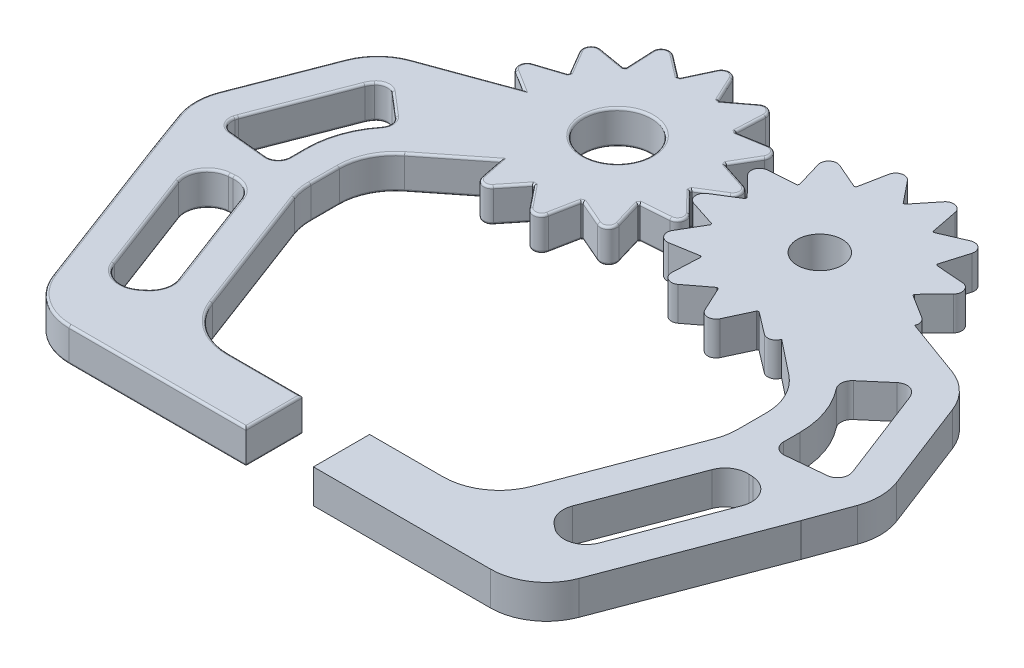
from build123d import *

# Parameters (mm, degrees)
BOSS_EXTRUDE1_DEPTH = 3
BOSS_EXTRUDE2_DEPTH = 3
SKETCH3_R           = 3
CUT_EXTRUDE1_DEPTH  = 3
BOSS_EXTRUDE3_DEPTH = 3
SKETCH5_R           = 1.9999999999999996
CUT_EXTRUDE2_DEPTH  = 10
FILLET1_R           = 0.2


with BuildPart() as part:
    # Sketch1 → Boss-Extrude1 (new body)
    with BuildSketch(Plane(origin=(0, 0, 0), x_dir=(1, 0, 0), z_dir=(0, 1, 0))):
        with BuildLine():
            Line((-8.32026915972251, 9.542312508941123), (-7.2740588316116535, 7.298707219998776))
            ThreePointArc((-7.2740588316116535, 7.298707219998776), (-7.205132517843315, 7.282063630695389), (-7.136366636375814, 7.264769141960864))
            Line((-7.136366636375814, 7.264769141960864), (-5.167338030557971, 8.765184781937645))
            ThreePointArc((-5.167338030557971, 8.765184781937645), (-4.364224257548944, 8.83273271414079), (-3.963594493865928, 8.133411437478186))
            Line((-3.963594493865928, 8.133411437478186), (-4.07987662143101, 5.660599432892145))
            ThreePointArc((-4.07987662143101, 5.660599432892145), (-4.026580063194036, 5.613830611283259), (-3.9737280487528657, 5.5665600034587195))
            Line((-3.9737280487528657, 5.5665600034587195), (-1.532961889453826, 5.980058853319892))
            ThreePointArc((-1.532961889453826, 5.980058853319892), (-0.7904488705394567, 5.6666439968047815), (-0.7606996341986512, 4.86124382392247))
            Line((-0.7606996341986512, 4.86124382392247), (-2.0128353833660646, 2.7257165333282076))
            ThreePointArc((-2.0128353833660646, 2.7257165333282076), (-1.9873781798593884, 2.6595366528190167), (-1.9625477920172012, 2.593119052484485))
            Line((-1.9625477920172012, 2.593119052484485), (0.3908058080885112, 1.8249735089281953))
            ThreePointArc((0.3908058080885112, 1.8249735089281953), (0.9026172885268505, 1.2023954302639746), (0.5546708059969309, 0.4754238346450154))
            Line((0.5546708059969309, 0.4754238346450154), (-1.5464693545101504, -0.8335951755760636))
            ThreePointArc((-1.5464693545101504, -0.8335951755760636), (-1.5546834442645956, -0.9040251019149228), (-1.563563025637423, -0.97437422294166))
            Line((-1.563563025637423, -0.97437422294166), (0.1632530664760889, -2.7481912730439846))
            ThreePointArc((0.1632530664760889, -2.7481912730439846), (0.32711316626695397, -3.5373074389145374), (-0.31881868919576145, -4.019310025671297))
            Line((-0.31881868919576145, -4.019310025671297), (-2.7876173717542465, -4.201940275666751))
            ThreePointArc((-2.7876173717542465, -4.201940275666751), (-2.8276210057975746, -4.260485600483667), (-2.8681763513034584, -4.318650106374195))
            Line((-2.8681763513034584, -4.318650106374195), (-2.1634905234954904, -6.691778553656916))
            ThreePointArc((-2.1634905234954904, -6.691778553656916), (-2.385120178485919, -7.466655803013577), (-3.1810622031176425, -7.5932683970430315))
            Line((-3.1810622031176425, -7.5932683970430315), (-5.451947381802793, -6.607671497472004))
            ThreePointArc((-5.451947381802793, -6.607671497472004), (-5.514576209671734, -6.640920192399074), (-5.577516578400171, -6.673575295812158))
            Line((-5.577516578400171, -6.673575295812158), (-6.056396045663718, -9.102360012300897))
            ThreePointArc((-6.056396045663718, -9.102360012300897), (-6.612742772404009, -9.685483305599218), (-7.376354240502842, -9.427700487456391))
            Line((-7.376354240502842, -9.427700487456391), (-8.929093488011025, -7.49966481028036))
            ThreePointArc((-8.929093488011025, -7.49966481028036), (-8.999999999999998, -7.499999999999999), (-9.070906511988971, -7.499664810280359))
            Line((-9.070906511988971, -7.499664810280359), (-10.62364575949715, -9.42770048745639))
            ThreePointArc((-10.62364575949715, -9.42770048745639), (-11.387257227595983, -9.685483305599224), (-11.943603954336274, -9.102360012300897))
            Line((-11.943603954336274, -9.102360012300897), (-12.422483421599827, -6.673575295812158))
            ThreePointArc((-12.422483421599827, -6.673575295812158), (-12.48542379032826, -6.640920192399076), (-12.548052618197206, -6.6076714974720065))
            Line((-12.548052618197206, -6.6076714974720065), (-14.818937796882352, -7.593268397043037))
            ThreePointArc((-14.818937796882352, -7.593268397043037), (-15.61487982151408, -7.466655803013584), (-15.836509476504505, -6.6917785536569205))
            Line((-15.836509476504505, -6.6917785536569205), (-15.13182364869654, -4.318650106374199))
            ThreePointArc((-15.13182364869654, -4.318650106374199), (-15.172378994202422, -4.260485600483667), (-15.212382628245752, -4.201940275666751))
            Line((-15.212382628245752, -4.201940275666751), (-17.681181310804234, -4.0193100256713))
            ThreePointArc((-17.681181310804234, -4.0193100256713), (-18.32711316626695, -3.5373074389145396), (-18.163253066476084, -2.7481912730439872))
            Line((-18.163253066476084, -2.7481912730439872), (-16.436436974362575, -0.97437422294166))
            ThreePointArc((-16.436436974362575, -0.97437422294166), (-16.445316555735403, -0.9040251019149261), (-16.453530645489845, -0.8335951755760688))
            Line((-16.453530645489845, -0.8335951755760688), (-18.554670805996928, 0.4754238346450085))
            ThreePointArc((-18.554670805996928, 0.4754238346450085), (-18.902617288526848, 1.2023954302639674), (-18.39080580808851, 1.8249735089281884))
            Line((-18.39080580808851, 1.8249735089281884), (-16.0374522079828, 2.59311905248448))
            ThreePointArc((-16.0374522079828, 2.59311905248448), (-16.012621820140613, 2.6595366528190163), (-15.987164616633937, 2.7257165333282085))
            Line((-15.987164616633937, 2.7257165333282085), (-17.23930036580135, 4.861243823922467))
            ThreePointArc((-17.23930036580135, 4.861243823922467), (-17.209551129460547, 5.666643996804776), (-16.467038110546177, 5.980058853319887))
            Line((-16.467038110546177, 5.980058853319887), (-14.026271951247134, 5.566560003458716))
            ThreePointArc((-14.026271951247134, 5.566560003458716), (-13.973419936805964, 5.613830611283257), (-13.920123378568993, 5.66059943289214))
            Line((-13.920123378568993, 5.66059943289214), (-14.036405506134075, 8.133411437478182))
            ThreePointArc((-14.036405506134075, 8.133411437478182), (-13.635775742451063, 8.832732714140782), (-12.832661969442034, 8.765184781937643))
            Line((-12.832661969442034, 8.765184781937643), (-10.863633363624189, 7.264769141960862))
            ThreePointArc((-10.863633363624189, 7.264769141960862), (-10.794867482156684, 7.282063630695389), (-10.725941168388344, 7.298707219998776))
            Line((-10.725941168388344, 7.298707219998776), (-9.679730840277488, 9.542312508941123))
            ThreePointArc((-9.679730840277488, 9.542312508941123), (-9, 9.975348812635602), (-8.32026915972251, 9.542312508941123))
        make_face()
    extrude(amount=BOSS_EXTRUDE1_DEPTH)

    # Sketch3 → Cut-Extrude1 (cut)
    with BuildSketch(Plane(origin=(0, 3, 0), x_dir=(1, 0, 0), z_dir=(0, 1, 0))):
        with Locations(Location((-9, 0, 0), (0, 0, 270))):
            Circle(SKETCH3_R)
    extrude(amount=-CUT_EXTRUDE1_DEPTH, mode=Mode.SUBTRACT)



with BuildPart() as body_2:
    # Sketch2 → Boss-Extrude2 (new body)
    with BuildSketch(Plane(origin=(0, 0, 0), x_dir=(1, 0, 0), z_dir=(0, 1, 0))):
        with BuildLine():
            Line((11.943420646641036, 9.102419289971532), (12.42234902568069, 6.673644217848479))
            ThreePointArc((12.42234902568069, 6.673644217848479), (12.485290052018371, 6.640990381961248), (12.547919549450615, 6.607742948286211))
            Line((12.547919549450615, 6.607742948286211), (14.818784879316434, 7.593385579684269))
            ThreePointArc((14.818784879316434, 7.593385579684269), (15.614729453563658, 7.4667890146908595), (15.836374713308329, 6.691916228761162))
            Line((15.836374713308329, 6.691916228761162), (15.131736676687458, 4.318773590704409))
            ThreePointArc((15.131736676687458, 4.318773590704409), (15.172293193526045, 4.2606099015460295), (15.21229800657128, 4.202065382350745))
            Line((15.21229800657128, 4.202065382350745), (17.681100366512805, 4.019484850083378))
            ThreePointArc((17.681100366512805, 4.019484850083378), (18.327041928612402, 3.537495271467764), (18.163197720403158, 2.7483758058746197))
            Line((18.163197720403158, 2.7483758058746197), (16.436417350502705, 0.9745239807938582))
            ThreePointArc((16.436417350502705, 0.9745239807938582), (16.445298348593486, 0.9041750386020764), (16.45351385669331, 0.8337452776962431))
            Line((16.45351385669331, 0.8337452776962431), (18.554680378341672, -0.4752314186280363))
            ThreePointArc((18.554680378341672, -0.4752314186280363), (18.90264150085632, -1.2021960070091147), (18.390842558257134, -1.8247843926188032))
            Line((18.390842558257134, -1.8247843926188032), (16.03750442786194, -2.59297732882946))
            ThreePointArc((16.03750442786194, -2.59297732882946), (16.012675377569952, -2.6593954291951656), (15.9872195068263, -2.7255758223586524))
            Line((15.9872195068263, -2.7255758223586524), (17.239398261873443, -4.861077896491214))
            ThreePointArc((17.239398261873443, -4.861077896491214), (17.209665245021146, -5.666478668312662), (16.467158537935614, -5.979908477799127))
            Line((16.467158537935614, -5.979908477799127), (14.026384051920298, -5.56645878118228))
            ThreePointArc((14.026384051920298, -5.56645878118228), (13.973532989444935, -5.613730453353005), (13.920237373068682, -5.660500348260586))
            Line((13.920237373068682, -5.660500348260586), (14.036569299123181, -8.133310010607516))
            ThreePointArc((14.036569299123181, -8.133310010607516), (13.6359536187431, -8.832639355176532), (12.832838485588669, -8.765107596425096))
            Line((12.832838485588669, -8.765107596425096), (10.863779664178109, -7.264731609866681))
            ThreePointArc((10.863779664178109, -7.264731609866681), (10.795014131008132, -7.28202748343352), (10.72608815242927, -7.298672460800205))
            Line((10.72608815242927, -7.298672460800205), (9.679923007183724, -9.542298818304783))
            ThreePointArc((9.679923007183724, -9.542298818304783), (9.000200887708619, -9.975348810612823), (8.32046132690441, -9.542326195707528))
            Line((8.32046132690441, -9.542326195707528), (7.274205816352543, -7.298741976237317))
            ThreePointArc((7.274205816352543, -7.298741976237317), (7.205279167422684, -7.28209977500398), (7.136512937685543, -7.264806671108782))
            Line((7.136512937685543, -7.264806671108782), (5.167514548258975, -8.765261963895432))
            ThreePointArc((5.167514548258975, -8.765261963895432), (4.364402135721049, -8.832826069522877), (3.9637582888975738, -8.133512861050301))
            Line((3.9637582888975738, -8.133512861050301), (4.079990617926086, -5.660698515228017))
            ThreePointArc((4.079990617926086, -5.660698515228017), (4.026693117850007, -5.613930766936794), (3.973840151464462, -5.566661223477609))
            Line((3.973840151464462, -5.566661223477609), (1.5330823198715684, -5.980209226415413))
            ThreePointArc((1.5330823198715684, -5.980209226415413), (0.7905629894294881, -5.666809322998758), (0.7607975336122383, -4.861409749382212))
            Line((0.7607975336122383, -4.861409749382212), (2.012890276392112, -2.725857243192335))
            ThreePointArc((2.012890276392112, -2.725857243192335), (1.9874317401327382, -2.6596778753642805), (1.9626000147504232, -2.593260775087857))
            Line((1.9626000147504232, -2.593260775087857), (-0.3907690541113881, -1.8251626244974668))
            ThreePointArc((-0.3907690541113881, -1.8251626244974668), (-0.9025930721813178, -1.2025948530311967), (-0.5546612297772351, -0.47561625046917916))
            Line((-0.5546612297772351, -0.47561625046917916), (1.5464525687364366, 0.8334450731178134))
            ThreePointArc((1.5464525687364366, 0.8334450731178134), (1.5546652401421683, 0.9038751648611306), (1.5635434047934407, 0.9742244646942927))
            Line((1.5635434047934407, 0.9742244646942927), (-0.1633084088328192, 2.7480067390987917))
            ThreePointArc((-0.1633084088328192, 2.7480067390987917), (-0.3271844001388486, 3.5371196049267355), (0.318737748425035, 4.019135199629166))
            Line((0.318737748425035, 4.019135199629166), (2.7875327525992333, 4.201815167278632))
            ThreePointArc((2.7875327525992333, 4.201815167278632), (2.8275352076244387, 4.260361297693441), (2.868089381781175, 4.318526620292534))
            Line((2.868089381781175, 4.318526620292534), (2.1633557630719014, 6.691640875838782))
            ThreePointArc((2.1633557630719014, 6.691640875838782), (2.3849698132181945, 7.4665225883081625), (3.1809092879116303, 7.59315121132231))
            Line((3.1809092879116303, 7.59315121132231), (5.4518143144951265, 6.60760004397802))
            ThreePointArc((5.4518143144951265, 6.60760004397802), (5.514442472775373, 6.6408500001436375), (5.577382183869041, 6.6735063710693305))
            Line((5.577382183869041, 6.6735063710693305), (6.056212739162261, 9.102300730938746))
            ThreePointArc((6.056212739162261, 9.102300730938746), (6.612547722611185, 9.685435228059784), (7.376164381892408, 9.427667787893446))
            Line((7.376164381892408, 9.427667787893446), (8.928942456667253, 7.499663380814869))
            ThreePointArc((8.928942456667253, 7.499663380814869), (8.999848961891665, 7.499999998479167), (9.070755480616457, 7.4996662367043205))
            Line((9.070755480616457, 7.4996662367043205), (10.62345590022824, 9.42773318319588))
            ThreePointArc((10.62345590022824, 9.42773318319588), (11.387062176835007, 9.685531379210657), (11.943420646641036, 9.102419289971532))
        make_face()
    extrude(amount=BOSS_EXTRUDE2_DEPTH)


with BuildPart() as part_1:
    add(part.part)

    add(body_2.part)  # Boss-Extrude3 merges body 2
    # Sketch4 → Boss-Extrude3 (add)
    # profile 1 of 2: a face of its own
    with BuildSketch(Plane(origin=(0, 3, 0), x_dir=(1, 0, 0), z_dir=(0, 1, 0))):
        with BuildLine():
            Line((-12, 0), (-15, 0))
            Line((-15, 0), (-24.063417074059288, -3.298814035697665))
            ThreePointArc((-24.063417074059288, -3.298814035697665), (-25.85454510614932, -4.427767754690947), (-27.017878157162077, -6.196759653877833))
            Line((-27.017878157162077, -6.196759653877833), (-30.146834392646337, -14.302879058208777))
            ThreePointArc((-30.146834392646337, -14.302879058208777), (-30.482039475216727, -16.055114843064764), (-30.180735696844767, -17.81349726058653))
            Line((-30.180735696844767, -17.81349726058653), (-28.845259169497112, -21.48268886368583))
            ThreePointArc((-28.845259169497112, -21.48268886368583), (-28.834592468379938, -21.511715769108086), (-28.823746442220965, -21.54067614665525))
            Line((-28.823746442220965, -21.54067614665525), (-23.42086378400779, -35.832393577627286))
            ThreePointArc((-23.42086378400779, -35.832393577627286), (-21.586408790113275, -38.177725079976085), (-18.743913407354402, -39.0643055780295))
            Line((-18.743913407354402, -39.0643055780295), (-2.9999999999999973, -39.06430557802947))
            Line((-2.9999999999999973, -39.06430557802947), (-2.999999999999995, -34.0643055780295))
            Line((-2.999999999999995, -34.0643055780295), (-9.548771612533102, -34.0643055780295))
            ThreePointArc((-9.548771612533102, -34.0643055780295), (-12.391266995291975, -33.17772507997607), (-14.22572198918649, -30.832393577627283))
            Line((-14.22572198918649, -30.832393577627283), (-18.670113991755716, -19.07607779745121))
            ThreePointArc((-18.670113991755716, -19.07607779745121), (-18.91173819943399, -18.20666886090458), (-18.99316361510232, -17.307989797853402))
            Line((-18.99316361510232, -17.307989797853402), (-18.99316361510232, -14.76495875194751))
            ThreePointArc((-18.99316361510232, -14.76495875194751), (-18.494843488176148, -12.588981196833053), (-17.099212286957545, -10.846737006299845))
            Line((-17.099212286957545, -10.846737006299845), (-11.233353665963485, -6.196759653877833))
            Line((-11.233353665963485, -6.196759653877833), (-12, -5.200385990842216))
            Line((-12, -5.200385990842216), (-12, 0))
        make_face()
        with BuildLine():
            Line((-24.219141077323414, -7.277070145327466), (-27.348097312807674, -15.383189549658415))
            ThreePointArc((-27.348097312807674, -15.383189549658415), (-27.391982380778803, -15.509251337684425), (-27.42736089782193, -15.63795966734096))
            ThreePointArc((-27.42736089782193, -15.63795966734096), (-27.268909504558284, -16.451412967212818), (-26.551328527375524, -16.866009947767477))
            Line((-26.551328527375524, -16.866009947767477), (-23.089675397109268, -17.201667160924675))
            ThreePointArc((-23.089675397109268, -17.201667160924675), (-22.32104449694205, -16.946778355780893), (-21.993163615102315, -16.20633531880675))
            Line((-21.993163615102315, -16.20633531880675), (-21.993163615102315, -14.7649587519475))
            ThreePointArc((-21.993163615102315, -14.7649587519475), (-21.544176267965852, -12.122571967940548), (-20.247611636028644, -9.776784741998526))
            ThreePointArc((-20.247611636028644, -9.776784741998526), (-20.033904843359444, -9.058635962777394), (-20.379087159218226, -8.393611578902545))
            Line((-20.379087159218226, -8.393611578902545), (-22.473694408503057, -6.6004378739851415))
            ThreePointArc((-22.473694408503057, -6.6004378739851415), (-23.209885528261832, -6.363782129162567), (-23.894733418427563, -6.7229014320477685))
            ThreePointArc((-23.894733418427563, -6.7229014320477685), (-24.07932327487177, -6.986881117788997), (-24.219141077323414, -7.277070145327466))
        make_face(mode=Mode.SUBTRACT)
        with BuildLine():
            Line((-21.589342284851647, -32.19339776059977), (-25.07235384075273, -22.98012771297467))
            ThreePointArc((-25.07235384075273, -22.98012771297467), (-24.888606920379818, -21.19868635047283), (-23.352156158021938, -20.278569339637336))
            Line((-23.352156158021938, -20.278569339637336), (-22.96847863119698, -20.249599556982975))
            ThreePointArc((-22.96847863119698, -20.249599556982975), (-21.743690000603678, -20.556889500192728), (-20.94711601260503, -21.536687530642066))
            Line((-20.94711601260503, -21.536687530642066), (-17.545083905804617, -30.53575055629838))
            ThreePointArc((-17.545083905804617, -30.53575055629838), (-17.486354183386762, -31.769285717841722), (-18.16327816241805, -32.8021613646025))
            Line((-18.16327816241805, -32.8021613646025), (-18.46597624014234, -33.04533816922565))
            ThreePointArc((-18.46597624014234, -33.04533816922565), (-20.2448620958945, -33.41567243383988), (-21.589342284851647, -32.19339776059977))
        make_face(mode=Mode.SUBTRACT)
    # profile 2 of 2: a face of its own
    with BuildSketch(Plane(origin=(0, 3, 0), x_dir=(1, 0, 0), z_dir=(0, 1, 0))):
        with BuildLine():
            Line((23.42086378400779, -35.832393577627286), (28.823746442220965, -21.54067614665525))
            ThreePointArc((28.823746442220965, -21.54067614665525), (28.834592468379938, -21.511715769108086), (28.845259169497112, -21.48268886368583))
            Line((28.845259169497112, -21.48268886368583), (30.180735696844767, -17.81349726058653))
            ThreePointArc((30.180735696844767, -17.81349726058653), (30.482039475216727, -16.055114843064764), (30.146834392646337, -14.302879058208777))
            Line((30.146834392646337, -14.302879058208777), (27.017878157162077, -6.196759653877833))
            ThreePointArc((27.017878157162077, -6.196759653877833), (25.85454510614932, -4.427767754690949), (24.063417074059288, -3.298814035697665))
            Line((24.063417074059288, -3.298814035697665), (15, 0))
            Line((15, 0), (12, 0))
            Line((12, 0), (12, -5.200385990842216))
            Line((12, -5.200385990842216), (11.233353665963485, -6.196759653877833))
            Line((11.233353665963485, -6.196759653877833), (17.099212286957545, -10.846737006299845))
            ThreePointArc((17.099212286957545, -10.846737006299845), (18.494843488176148, -12.588981196833053), (18.99316361510232, -14.76495875194751))
            Line((18.99316361510232, -14.76495875194751), (18.99316361510232, -17.307989797853402))
            ThreePointArc((18.99316361510232, -17.307989797853402), (18.91173819943399, -18.20666886090458), (18.670113991755716, -19.07607779745121))
            Line((18.670113991755716, -19.07607779745121), (14.22572198918649, -30.832393577627283))
            ThreePointArc((14.22572198918649, -30.832393577627283), (12.391266995291975, -33.17772507997607), (9.548771612533102, -34.0643055780295))
            Line((9.548771612533102, -34.0643055780295), (2.999999999999995, -34.0643055780295))
            Line((2.999999999999995, -34.0643055780295), (2.9999999999999973, -39.06430557802947))
            Line((2.9999999999999973, -39.06430557802947), (18.743913407354402, -39.0643055780295))
            ThreePointArc((18.743913407354402, -39.0643055780295), (21.586408790113275, -38.177725079976085), (23.42086378400779, -35.832393577627286))
        make_face()
        with BuildLine():
            Line((21.589342284851647, -32.19339776059977), (25.07235384075273, -22.98012771297467))
            ThreePointArc((25.07235384075273, -22.98012771297467), (24.888606920379818, -21.19868635047283), (23.352156158021938, -20.278569339637336))
            Line((23.352156158021938, -20.278569339637336), (22.96847863119698, -20.249599556982975))
            ThreePointArc((22.96847863119698, -20.249599556982975), (21.743690000603678, -20.556889500192728), (20.94711601260503, -21.536687530642066))
            Line((20.94711601260503, -21.536687530642066), (17.545083905804617, -30.53575055629838))
            ThreePointArc((17.545083905804617, -30.53575055629838), (17.486354183386762, -31.769285717841722), (18.16327816241805, -32.8021613646025))
            Line((18.16327816241805, -32.8021613646025), (18.46597624014234, -33.04533816922565))
            ThreePointArc((18.46597624014234, -33.04533816922565), (20.2448620958945, -33.41567243383988), (21.589342284851647, -32.19339776059977))
        make_face(mode=Mode.SUBTRACT)
        with BuildLine():
            Line((24.219141077323414, -7.277070145327466), (27.348097312807674, -15.383189549658415))
            ThreePointArc((27.348097312807674, -15.383189549658415), (27.391982380778803, -15.509251337684427), (27.42736089782193, -15.63795966734096))
            ThreePointArc((27.42736089782193, -15.63795966734096), (27.268909504558284, -16.451412967212818), (26.551328527375524, -16.866009947767477))
            Line((26.551328527375524, -16.866009947767477), (23.089675397109268, -17.201667160924675))
            ThreePointArc((23.089675397109268, -17.201667160924675), (22.32104449694205, -16.946778355780893), (21.993163615102315, -16.20633531880675))
            Line((21.993163615102315, -16.20633531880675), (21.993163615102315, -14.7649587519475))
            ThreePointArc((21.993163615102315, -14.7649587519475), (21.544176267965852, -12.122571967940548), (20.247611636028644, -9.776784741998526))
            ThreePointArc((20.247611636028644, -9.776784741998526), (20.033904843359444, -9.058635962777394), (20.379087159218226, -8.393611578902545))
            Line((20.379087159218226, -8.393611578902545), (22.473694408503057, -6.6004378739851415))
            ThreePointArc((22.473694408503057, -6.6004378739851415), (23.209885528261832, -6.363782129162567), (23.894733418427563, -6.7229014320477685))
            ThreePointArc((23.894733418427563, -6.7229014320477685), (24.07932327487177, -6.986881117788996), (24.219141077323414, -7.277070145327466))
        make_face(mode=Mode.SUBTRACT)
    extrude(amount=-BOSS_EXTRUDE3_DEPTH)

    # Sketch5 → Cut-Extrude2 (cut)
    with BuildSketch(Plane(origin=(0, 3, 0), x_dir=(1, 0, 0), z_dir=(0, 1, 0))):
        with Locations(Location((9, 0, 0), (0, 0, 270))):
            Circle(SKETCH5_R)
    extrude(amount=-CUT_EXTRUDE2_DEPTH, mode=Mode.SUBTRACT)

    # Fillet1
    fillet1_edges = [part_1.edges().sort_by_distance(p)[0] for p in [
        (-8.999999999999998, 3, -9.975348812635602),
        (-5.514576209671734, 3, 6.640920192399074),
        (-4.316504792460218, 3, 7.100469947257517),
        (-2.3851201784859173, 3, 7.466655803013575),
        (-2.5158334373994746, 3, 5.505214330015555),
        (-2.8276210057975737, 3, 4.260485600483668),
        (-1.5532180304750038, 3, 4.110625150669025),
        (0.3271131662669539, 3, 3.5373074389145374),
        (-0.7001549795806671, 3, 1.8612827479928225),
        (-1.5546834442645947, 3, 0.9040251019149228),
        (-0.49589927425660985, 3, 0.1790856704655241),
        (-10.202836004332916, 3, -8.420509864469949),
        (0.9026172885268506, 3, -1.2023954302639739),
        (-0.785870991964345, 3, -2.2090462807063402),
        (-1.9873781798593884, 3, -2.659536652819017),
        (-1.3867675087823579, 3, -3.7934801786253387),
        (-0.7904488705394563, 3, -5.6666439968047815),
        (-2.753344969103346, 3, -5.773309428389306),
        (-8.999999999999998, 0, -3),
        (-8.999999999999998, 3, -3),
        (-4.026580063194035, 3, -5.61383061128326),
        (-12.143327776934123, 0, 8.089399129646475),
        (-4.021735557648469, 3, -6.897005435185165),
        (-12.143327776934123, 3, 8.089399129646475),
        (-4.364224257548942, 3, -8.83273271414079),
        (-14.72113194324476, 0, 8.96158762664595),
        (-20.412760179263884, 0, 1.9700835904734524),
        (-6.151852333466893, 3, -8.014976961949255),
        (-27.391982380778803, 0, 15.509251337684427),
        (-27.268909504558284, 0, 16.451412967212818),
        (-24.820501962242396, 0, 17.033838554346076),
        (-22.32104449694205, 0, 16.946778355780893),
        (-21.993163615102315, 0, 15.485647035377125),
        (-21.544176267965852, 0, 12.122571967940548),
        (-20.033904843359444, 0, 9.058635962777396),
        (-21.42639078386064, 0, 7.497024726443843),
        (-23.209885528261832, 0, 6.363782129162568),
        (-24.07932327487177, 0, 6.986881117788997),
        (-10.794867482156684, 3, -7.282063630695388),
        (-25.783619195065544, 0, 11.330129847492941),
        (-18.314627201280196, 0, 32.92374976691407),
        (-17.486354183386762, 0, 31.769285717841722),
        (-19.246099959204823, 0, 26.036219043470226),
        (-21.743690000603678, 0, 20.556889500192728),
        (-23.160317394609457, 0, 20.264084448310157),
        (-24.888606920379818, 0, 21.19868635047283),
        (-23.330848062802186, 0, 27.58676273678722),
        (-20.2448620958945, 0, 33.41567243383988),
        (-20.412760179263884, 3, 1.9700835904734524),
        (-25.85454510614932, 3, 4.427767754690948),
        (-28.582356274904207, 3, 10.249819356043304),
        (-30.482039475216727, 3, 16.055114843064764),
        (-29.512997433170938, 3, 19.64809306213618),
        (-28.834592468379938, 3, 21.511715769108086),
        (-26.12230511311438, 3, 28.68653486214127),
        (-21.58640879011328, 3, 38.177725079976085),
        (-10.8719567036772, 3, 39.06430557802948),
        (-2.9999999999999964, 3, 36.56430557802948),
        (-6.274385806266549, 3, 34.0643055780295),
        (-12.391266995291971, 3, 33.17772507997607),
        (-16.447917990471105, 3, 24.954235687539246),
        (-18.91173819943399, 3, 18.20666886090458),
        (-18.99316361510232, 3, 16.036474274900456),
        (-18.494843488176148, 3, 12.588981196833053),
        (-14.72113194324476, 3, 8.96158762664595),
        (-18.494843488176148, 0, 12.588981196833053),
        (-18.99316361510232, 0, 16.036474274900456),
        (-18.91173819943399, 0, 18.20666886090458),
        (-16.447917990471105, 0, 24.954235687539246),
        (-12.391266995291971, 0, 33.17772507997607),
        (-6.274385806266549, 0, 34.0643055780295),
        (-2.9999999999999964, 0, 36.56430557802948),
        (-10.8719567036772, 0, 39.06430557802948),
        (-21.58640879011328, 0, 38.177725079976085),
        (-26.12230511311438, 0, 28.68653486214127),
        (-28.834592468379938, 0, 21.511715769108086),
        (-29.512997433170938, 0, 19.64809306213618),
        (-30.482039475216727, 0, 16.055114843064764),
        (-28.582356274904207, 0, 10.249819356043304),
        (-25.85454510614932, 0, 4.427767754690948),
        (-17.486354183386762, 3, 31.769285717841722),
        (-18.314627201280196, 3, 32.92374976691407),
        (-20.2448620958945, 3, 33.41567243383988),
        (-23.330848062802186, 3, 27.58676273678722),
        (-24.888606920379818, 3, 21.19868635047283),
        (-23.160317394609457, 3, 20.264084448310157),
        (-21.743690000603678, 3, 20.556889500192728),
        (-19.246099959204823, 3, 26.036219043470226),
        (-27.268909504558284, 3, 16.451412967212818),
        (-27.391982380778803, 3, 15.509251337684427),
        (-25.783619195065544, 3, 11.330129847492941),
        (-24.07932327487177, 3, 6.986881117788997),
        (-23.209885528261832, 3, 6.363782129162568),
        (-21.42639078386064, 3, 7.497024726443843),
        (-20.033904843359444, 3, 9.058635962777396),
        (-21.544176267965852, 3, 12.122571967940548),
        (-21.993163615102315, 3, 15.485647035377125),
        (-22.32104449694205, 3, 16.946778355780893),
        (-24.820501962242396, 3, 17.033838554346076),
        (-11.84814766653311, 3, -8.014976961949252),
        (-13.635775742451061, 3, -8.832732714140782),
        (-13.978264442351534, 3, -6.897005435185161),
        (-13.973419936805968, 3, -5.613830611283256),
        (-15.246655030896655, 3, -5.773309428389302),
        (-17.209551129460543, 3, -5.666643996804778),
        (-16.613232491217644, 3, -3.793480178625338),
        (-7.205132517843316, 3, -7.28206363069539),
        (-16.012621820140613, 3, -2.659536652819015),
        (-6.151852333466893, 0, -8.014976961949255),
        (-17.214129008035655, 3, -2.2090462807063345),
        (-4.364224257548942, 0, -8.83273271414079),
        (-4.021735557648469, 0, -6.897005435185165),
        (-4.026580063194035, 0, -5.61383061128326),
        (-2.753344969103346, 0, -5.773309428389306),
        (-0.7904488705394563, 0, -5.6666439968047815),
        (-1.3867675087823579, 0, -3.7934801786253387),
        (-1.9873781798593884, 0, -2.659536652819017),
        (-18.902617288526848, 3, -1.2023954302639672),
        (-0.785870991964345, 0, -2.2090462807063402),
        (0.9026172885268506, 0, -1.2023954302639739),
        (-0.49589927425660985, 0, 0.1790856704655241),
        (-1.5546834442645947, 0, 0.9040251019149228),
        (-0.7001549795806671, 0, 1.8612827479928225),
        (0.3271131662669539, 0, 3.5373074389145374),
        (-1.5532180304750038, 0, 4.110625150669025),
        (-2.8276210057975737, 0, 4.260485600483668),
        (-17.658387045232704, 3, 0.08296465530211516),
        (-2.5158334373994746, 0, 5.505214330015555),
        (-2.3851201784859173, 0, 7.466655803013575),
        (-4.316504792460218, 0, 7.100469947257517),
        (-5.514576209671734, 0, 6.640920192399074),
        (-5.8169563120319445, 0, 7.887967654056528),
        (-6.612742772404007, 0, 9.685483305599218),
        (-8.152723864256934, 0, 8.463682648868376),
        (-8.999999999999998, 0, 7.500000000000002),
        (-9.84727613574306, 0, 8.463682648868375),
        (-11.387257227595985, 0, 9.685483305599224),
        (-17.658387045232704, 0, 0.08296465530211516),
        (-18.902617288526848, 0, -1.2023954302639672),
        (-17.214129008035655, 0, -2.2090462807063345),
        (-16.012621820140613, 0, -2.659536652819015),
        (-16.613232491217644, 0, -3.793480178625338),
        (-17.209551129460543, 0, -5.666643996804778),
        (-15.246655030896655, 0, -5.773309428389302),
        (-13.973419936805968, 0, -5.613830611283256),
        (-13.978264442351534, 0, -6.897005435185161),
        (-13.635775742451061, 0, -8.832732714140782),
        (-11.84814766653311, 0, -8.014976961949252),
        (-10.794867482156684, 0, -7.282063630695388),
        (-10.202836004332916, 0, -8.420509864469949),
        (-8.999999999999998, 0, -9.975348812635602),
        (-7.797163995667082, 0, -8.420509864469949),
        (-7.205132517843316, 0, -7.28206363069539),
        (-7.797163995667082, 3, -8.420509864469949),
        (-11.387257227595985, 3, 9.685483305599224),
        (-9.84727613574306, 3, 8.463682648868375),
        (-8.999999999999998, 3, 7.500000000000002),
        (-8.152723864256934, 3, 8.463682648868376),
        (-6.612742772404007, 3, 9.685483305599218),
        (-5.8169563120319445, 3, 7.887967654056528),
    ]]
    fillet(fillet1_edges, radius=FILLET1_R)


solid = part_1.part
